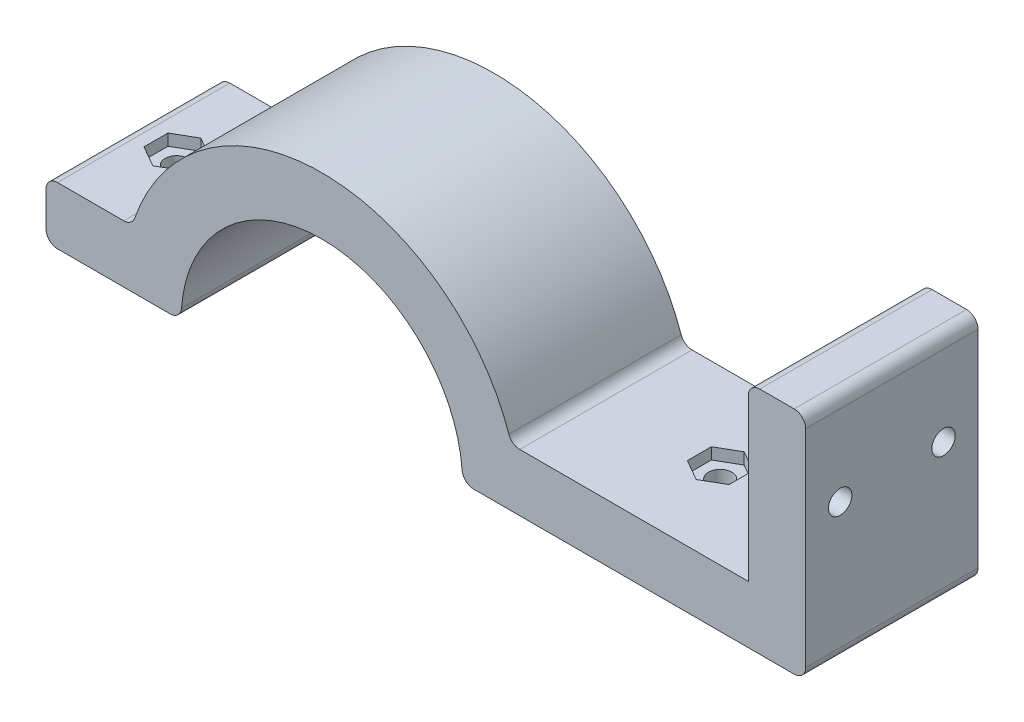
from build123d import *

# Parameters (mm, degrees)
BOSS_EXTRUDE1_DEPTH            = 38.1
FILLET1_R                      = 2.54
CUT_EXTRUDE1_DEPTH             = 2.54
F_6_0_204_DIAMETER_HOLE1_D     = 5.1816
F_6_0_204_DIAMETER_HOLE1_DEPTH = 12.7
F_6_0_204_DIAMETER_HOLE1_TIP   = 1.556709692
CUT_EXTRUDE2_DEPTH             = 2.54
F_6_0_204_DIAMETER_HOLE2_D     = 5.1816
F_6_0_204_DIAMETER_HOLE2_DEPTH = 12.7
F_6_0_204_DIAMETER_HOLE2_TIP   = 1.556709692


with BuildPart() as part:
    # Sketch1 → Boss-Extrude1 (new body)
    with BuildSketch(Plane.XY):
        with BuildLine():
            ThreePointArc((-73.049046132, 12.7), (-31.115, 43.815), (10.819046132, 12.7))
            Line((10.819046132, 12.7), (63.1825, 12.7))
            Line((63.1825, 12.7), (63.1825, 50.8))
            Line((63.1825, 50.8), (75.8825, 50.8))
            Line((75.8825, 50.8), (75.8825, 0))
            Line((75.8825, 0), (0, 0))
            ThreePointArc((0, 0), (-31.115, 31.115), (-62.23, 0))
            Line((-62.23, 0), (-92.099046132, 0))
            Line((-92.099046132, 0), (-92.099046132, 12.7))
            Line((-92.099046132, 12.7), (-73.049046132, 12.7))
        make_face()
    extrude(amount=BOSS_EXTRUDE1_DEPTH)

    # Fillet1
    fillet1_edges = [part.edges().sort_by_distance(p)[0] for p in [
        (10.819046132, 12.7, 19.05),
        (63.1825, 50.8, 19.05),
        (75.8825, 50.8, 19.05),
        (75.8825, 0, 19.05),
        (0, 0, 19.05),
        (-62.23, 0, 19.05),
        (-92.099046132, 0, 19.05),
        (-92.099046132, 12.7, 19.05),
        (-73.049046132, 12.7, 19.05),
    ]]
    fillet(fillet1_edges, radius=FILLET1_R)

    # Sketch3 → Cut-Extrude1 (cut)
    with BuildSketch(Plane(origin=(0, 12.7, 0), x_dir=(1, 0, 0), z_dir=(0, 1, 0))):
        Polygon((33.325436464, -16.395689872), (33.325436464, -21.704310128), (37.922836464, -24.358620255), (42.520236464, -21.704310128), (42.520236464, -16.395689872), (37.922836464, -13.741379745), align=None)
        Polygon((-82.22610953, -13.741379745), (-86.82350953, -16.395689872), (-86.82350953, -21.704310128), (-82.22610953, -24.358620255), (-77.62870953, -21.704310128), (-77.62870953, -16.395689872), align=None)
    extrude(amount=-CUT_EXTRUDE1_DEPTH, mode=Mode.SUBTRACT)

    # #6 (0.204) Diameter Hole1
    with Locations(Plane(origin=(0, 12.7, 0), x_dir=(1, 0, 0), z_dir=(0, 1, 0))):
        with Locations((-82.22610953, -19.05), (37.922836464, -19.05)):
            Hole(F_6_0_204_DIAMETER_HOLE1_D / 2, depth=F_6_0_204_DIAMETER_HOLE1_DEPTH)
            with Locations((0, 0, -(F_6_0_204_DIAMETER_HOLE1_DEPTH + F_6_0_204_DIAMETER_HOLE1_TIP / 2))):  # 118° drill point
                Cone(0, F_6_0_204_DIAMETER_HOLE1_D / 2, F_6_0_204_DIAMETER_HOLE1_TIP, mode=Mode.SUBTRACT)

    # Sketch6 → Cut-Extrude2 (cut)
    with BuildSketch(Plane.ZY.offset(-63.1825)):
        Polygon((12.350437166, 28.070765011), (12.071677287, 33.372061262), (7.341240122, 35.781296251), (2.889562834, 32.889234989), (3.168322713, 27.587938738), (7.898759878, 25.178703749), align=None)
        Polygon((35.210437166, 28.070765011), (34.931677287, 33.372061262), (30.201240122, 35.781296251), (25.749562834, 32.889234989), (26.028322713, 27.587938738), (30.758759878, 25.178703749), align=None)
    extrude(amount=-CUT_EXTRUDE2_DEPTH, mode=Mode.SUBTRACT)

    # #6 (0.204) Diameter Hole2
    with Locations(Plane.ZY.offset(-65.7225)):
        with Locations((30.48, 30.48), (7.62, 30.48)):
            Hole(F_6_0_204_DIAMETER_HOLE2_D / 2, depth=F_6_0_204_DIAMETER_HOLE2_DEPTH)
            with Locations((0, 0, -(F_6_0_204_DIAMETER_HOLE2_DEPTH + F_6_0_204_DIAMETER_HOLE2_TIP / 2))):  # 118° drill point
                Cone(0, F_6_0_204_DIAMETER_HOLE2_D / 2, F_6_0_204_DIAMETER_HOLE2_TIP, mode=Mode.SUBTRACT)


solid = part.part
